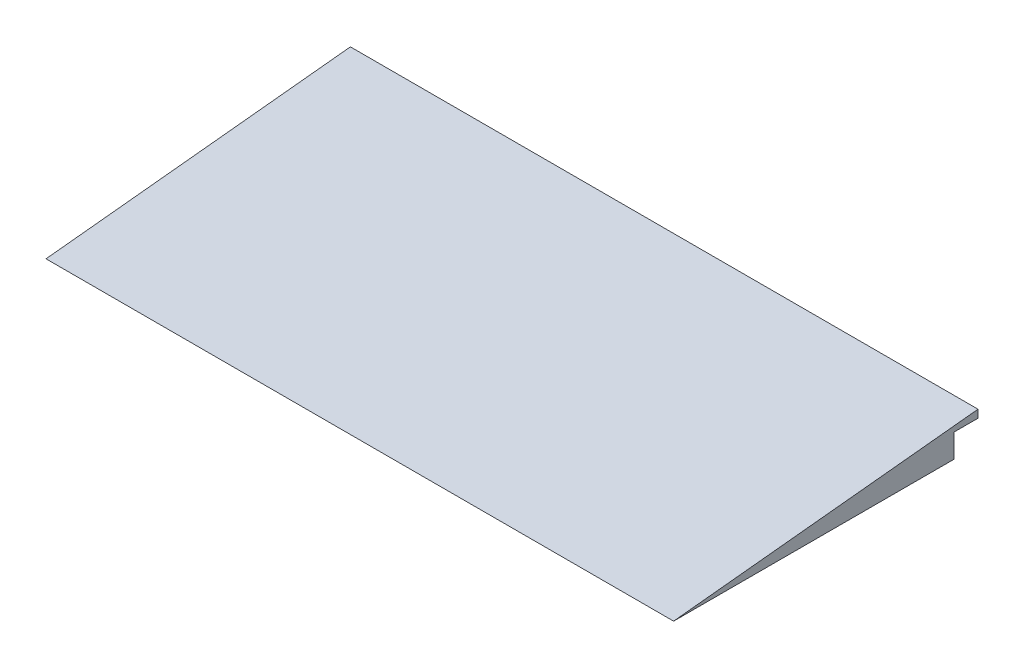
from build123d import *

# Parameters (mm, degrees)
BOSS_EXTRUDE1_DEPTH = 100
SKETCH3_W           = 7.7
SKETCH3_H           = 7.5
CUT_EXTRUDE1_DEPTH  = 207.039437972


with BuildPart() as part:
    # Sketch1 → Boss-Extrude1 (new, symmetric)
    with BuildSketch(Plane(origin=(0, 0, 0), x_dir=(0, 0, -1), z_dir=(1, 0, 0))):
        Polygon((-48.5, 0), (48.5, 10), (48.5, 0), align=None)
    extrude(amount=BOSS_EXTRUDE1_DEPTH, both=True)

    # Sketch3 → Cut-Extrude1 (cut, through all)
    with BuildSketch(Plane(origin=(100, 0, 0), x_dir=(0, 0, -1), z_dir=(1, 0, 0))):
        with Locations((44.65, 3.75)):
            Rectangle(SKETCH3_W, SKETCH3_H)
    extrude(amount=-CUT_EXTRUDE1_DEPTH, mode=Mode.SUBTRACT)


solid = part.part
